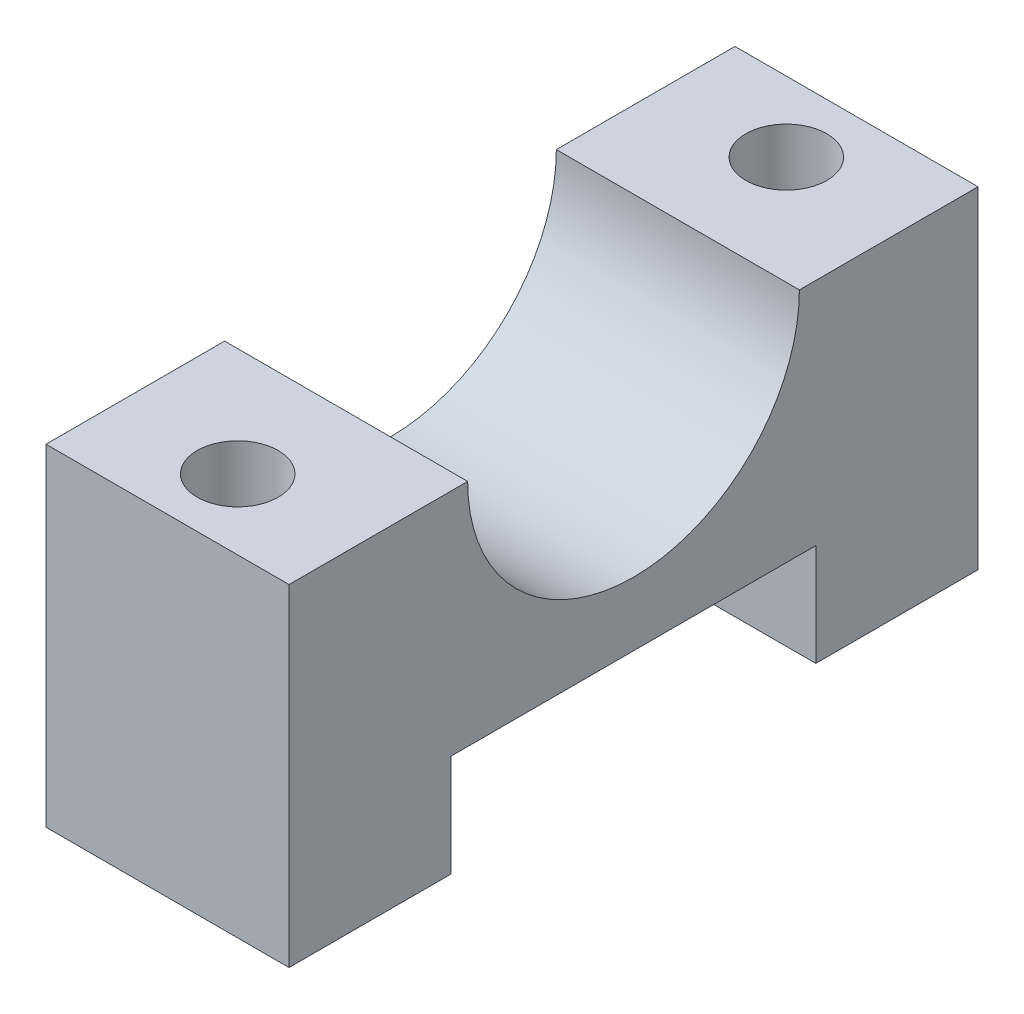
from build123d import *

# Parameters (mm, degrees)
BOSS_EXTRUDE1_DEPTH = 9.525
SKETCH3_W           = 14.2875
SKETCH3_H           = 4
CUT_EXTRUDE1_DEPTH  = 22.023216333
SKETCH4_R           = 1.5875
CUT_EXTRUDE2_DEPTH  = 22.023216333


with BuildPart() as part:
    # Sketch1 → Boss-Extrude1 (new body)
    with BuildSketch(Plane(origin=(0, 0, 0), x_dir=(0, 0, -1), z_dir=(1, 0, 0))):
        with BuildLine():
            Line((6.5, 0), (13.5, 0))
            Line((13.5, 0), (13.5, -13))
            Line((13.5, -13), (-13.5, -13))
            Line((-13.5, -13), (-13.5, 0))
            Line((-13.5, 0), (-6.5, 0))
            ThreePointArc((-6.5, 0), (0, -6.5), (6.5, 0))
        make_face()
    extrude(amount=BOSS_EXTRUDE1_DEPTH)

    # Sketch3 → Cut-Extrude1 (cut, through all)
    with BuildSketch(Plane(origin=(9.525, 0, 0), x_dir=(0, 0, -1), z_dir=(1, 0, 0))):
        with Locations((0, -11)):
            Rectangle(SKETCH3_W, SKETCH3_H)
    extrude(amount=-CUT_EXTRUDE1_DEPTH, mode=Mode.SUBTRACT)

    # Sketch4 → Cut-Extrude2 (cut, through all)
    with BuildSketch(Plane.XZ.offset(13)):
        with Locations(Location((4.7625, -10.75, 0), (0, 0, 270))):
            Circle(SKETCH4_R)
        with Locations(Location((4.7625, 10.75, 0), (0, 0, 270))):
            Circle(SKETCH4_R)
    extrude(amount=-CUT_EXTRUDE2_DEPTH, mode=Mode.SUBTRACT)


solid = part.part
